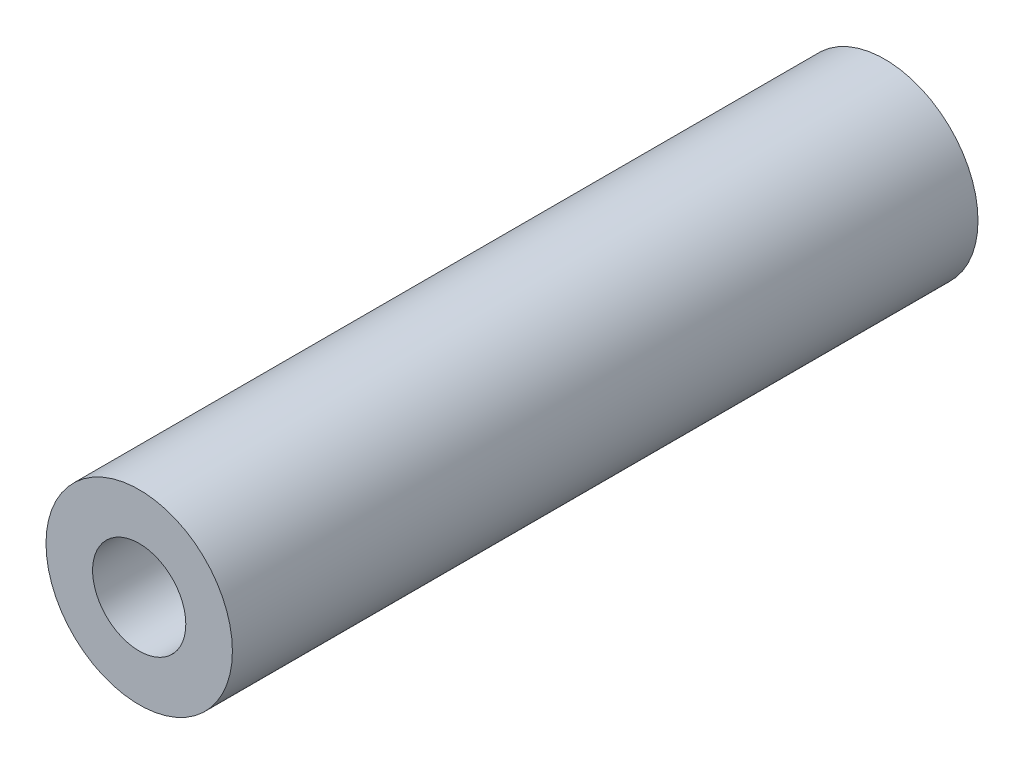
from build123d import *

# Parameters (mm, degrees)
BOSS_EXTRUDE1_DEPTH      = 12.7
BOSS_EXTRUDE1_DEPTH_BACK = 12.7
SKETCH1_R                = 3.175
SKETCH2_R                = 1.5875
CUT_EXTRUDE1_DEPTH       = 26.793821935


with BuildPart() as part:
    # Sketch1 → Boss-Extrude1 (new, two sides: drawn at the far end of the back side and taken through both)
    with BuildSketch(Plane.XY.offset(-BOSS_EXTRUDE1_DEPTH_BACK)):
        Circle(SKETCH1_R)
    extrude(amount=BOSS_EXTRUDE1_DEPTH + BOSS_EXTRUDE1_DEPTH_BACK)

    # Sketch2 → Cut-Extrude1 (cut, through all)
    with BuildSketch(Plane.XY.offset(12.7)):
        Circle(SKETCH2_R)
    extrude(amount=-CUT_EXTRUDE1_DEPTH, mode=Mode.SUBTRACT)


solid = part.part
